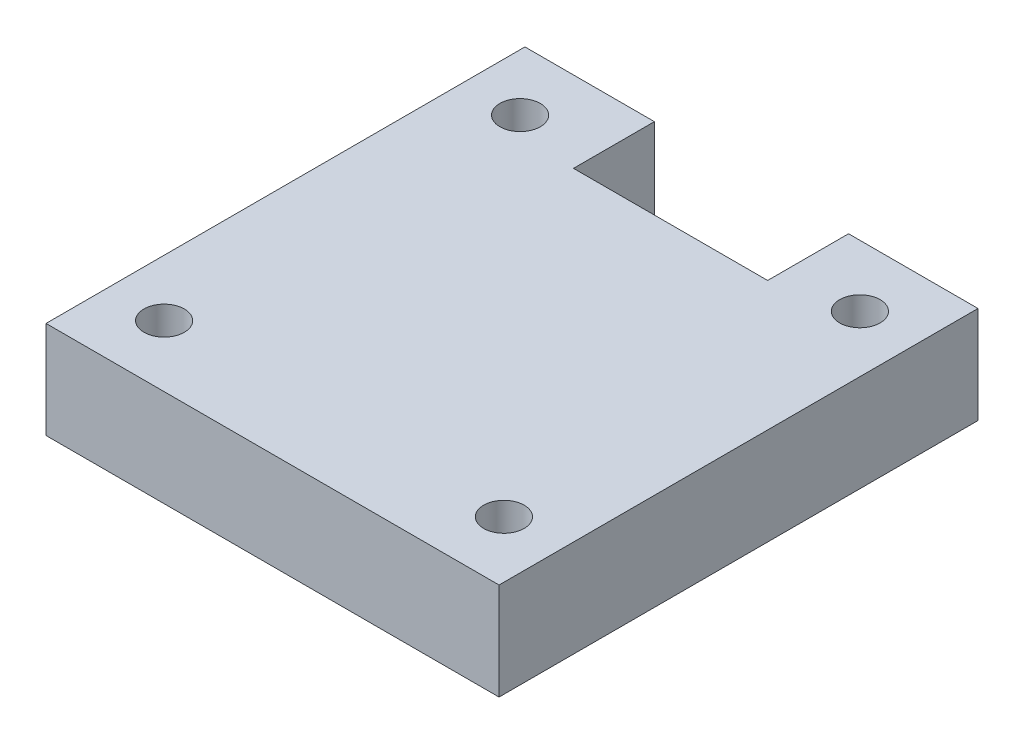
from build123d import *

# Parameters (mm, degrees)
SKETCH_2_W          = 28
SKETCH_2_H          = 29.6
SKETCH_2_R          = 1.25
EXTRUDE_1_DEPTH     = 6
SKETCH_3_W          = 12
SKETCH_3_H          = 5
CUT_EXTRUDE_2_DEPTH = 42.668813278


with BuildPart() as part:
    # 草图2 → 凸台-拉伸1 (new body)
    with BuildSketch(Plane(origin=(0, 6, 0), x_dir=(1, 0, 0), z_dir=(0, 1, 0))):
        with Locations((14.5, 15)):
            Rectangle(SKETCH_2_W, SKETCH_2_H)
        with Locations(Location((4, 26, 0), (0, 0, 270))):
            Circle(SKETCH_2_R, mode=Mode.SUBTRACT)
        with Locations(Location((25, 26, 0), (0, 0, 270))):
            Circle(SKETCH_2_R, mode=Mode.SUBTRACT)
        with Locations(Location((4, 4, 0), (0, 0, 270))):
            Circle(SKETCH_2_R, mode=Mode.SUBTRACT)
        with Locations(Location((25, 4, 0), (0, 0, 270))):
            Circle(SKETCH_2_R, mode=Mode.SUBTRACT)
    extrude(amount=EXTRUDE_1_DEPTH)

    # 草图3 → 切除-拉伸2 (cut, through all)
    with BuildSketch(Plane(origin=(0, 12, 0), x_dir=(1, 0, 0), z_dir=(0, 1, 0))):
        with Locations((14.5, 27.3)):
            Rectangle(SKETCH_3_W, SKETCH_3_H)
    extrude(amount=-CUT_EXTRUDE_2_DEPTH, mode=Mode.SUBTRACT)


solid = part.part
